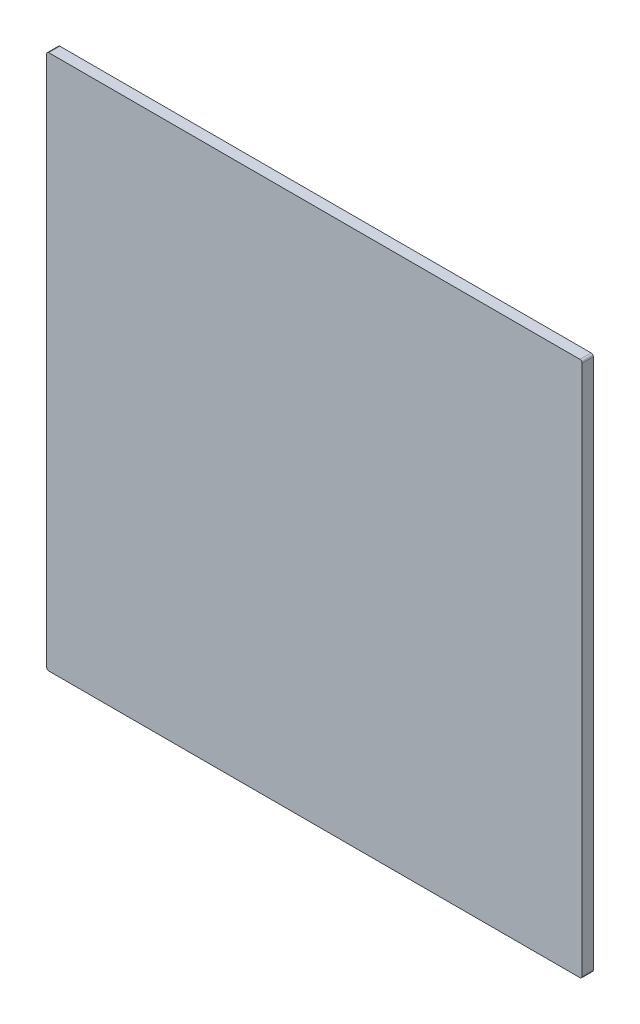
from build123d import *

# Parameters (mm, degrees)
SKETCH1_W           = 609.6
SKETCH1_H           = 609.6
BOSS_EXTRUDE1_DEPTH = 12.7
FILLET1_R           = 2.54


with BuildPart() as part:
    # Sketch1 → Boss-Extrude1 (new body)
    with BuildSketch(Plane.XY):
        with Locations((79.823295573, -44.073597285)):
            Rectangle(SKETCH1_W, SKETCH1_H)
    extrude(amount=BOSS_EXTRUDE1_DEPTH)

    # Fillet1
    fillet1_edges = [part.edges().sort_by_distance(p)[0] for p in [
        (-224.976704427, 260.726402715, 6.35),
        (-224.976704427, -348.873597285, 6.35),
        (384.623295573, -348.873597285, 6.35),
        (384.623295573, 260.726402715, 6.35),
    ]]
    fillet(fillet1_edges, radius=FILLET1_R)


solid = part.part
